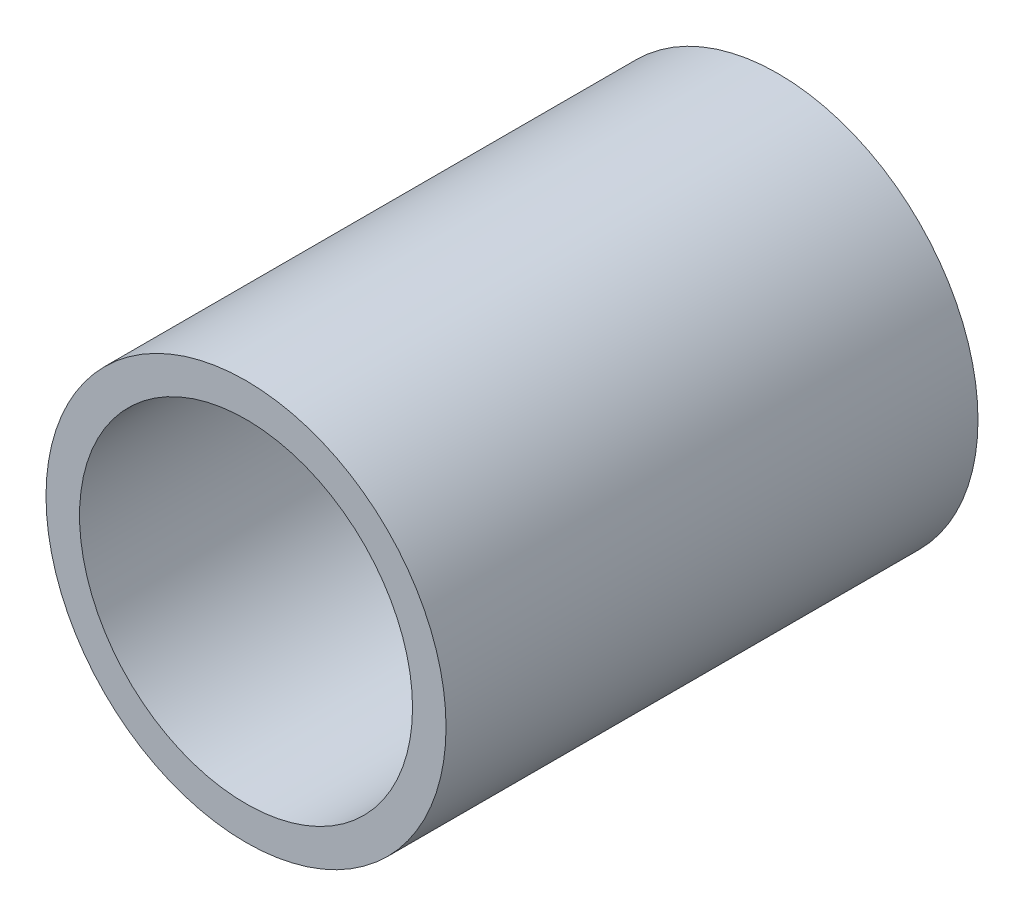
from build123d import *

# Parameters (mm, degrees)
BOSS_EXTRUDE1_DEPTH      = 12.7
BOSS_EXTRUDE1_DEPTH_BACK = 12.7
SKETCH5_R                = 9.5504
SKETCH5_R_2              = 7.9502


with BuildPart() as part:
    # Sketch5 → Boss-Extrude1 (new, two sides: drawn at the far end of the back side and taken through both)
    with BuildSketch(Plane.XY.offset(-BOSS_EXTRUDE1_DEPTH_BACK)):
        Circle(SKETCH5_R)
        Circle(SKETCH5_R_2, mode=Mode.SUBTRACT)
    extrude(amount=BOSS_EXTRUDE1_DEPTH + BOSS_EXTRUDE1_DEPTH_BACK)


solid = part.part
